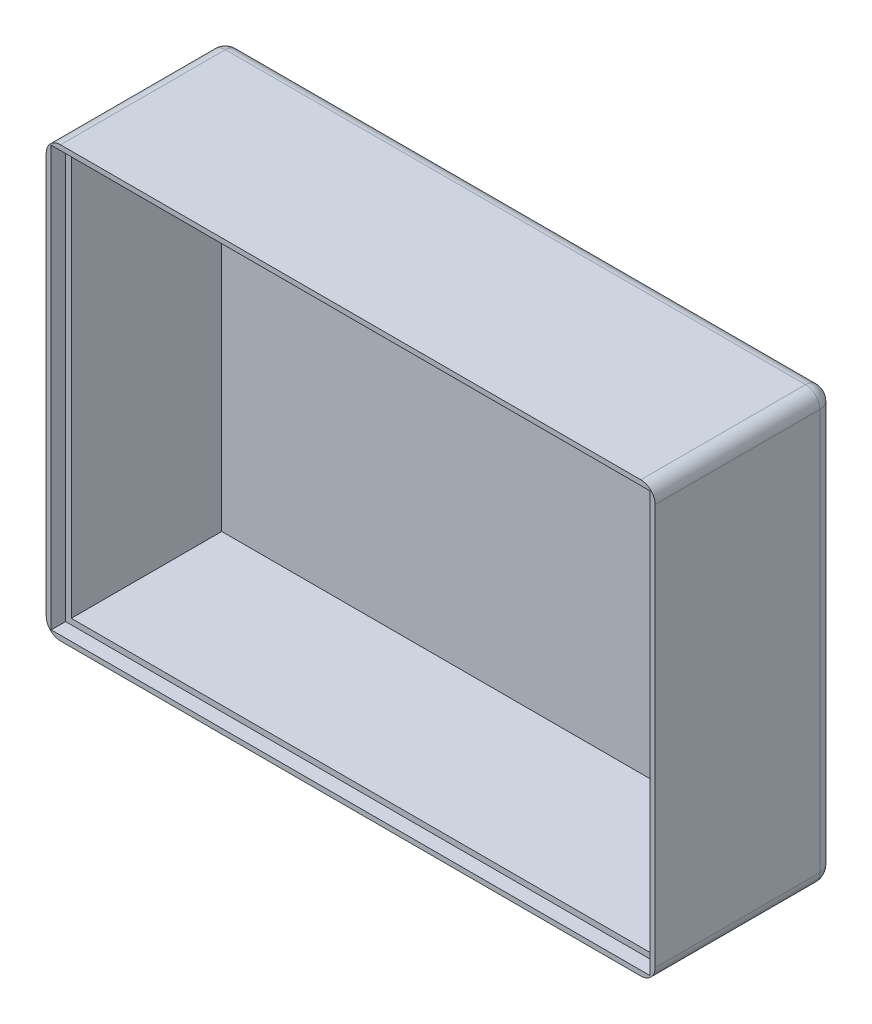
from build123d import *

# Parameters (mm, degrees)
SKETCH_1_W          = 85
SKETCH_1_H          = 60
EXTRUDE_1_DEPTH     = 25
SKETCH_2_W          = 82
SKETCH_2_H          = 57
CUT_EXTRUDE_1_DEPTH = 23
SKETCH_3_W          = 83.6
SKETCH_3_H          = 58.6
CUT_EXTRUDE_2_DEPTH = 2
FILLET_1_R          = 2


with BuildPart() as part:
    # 草图1 → 凸台-拉伸1 (new body)
    with BuildSketch(Plane.XY):
        with Locations((42.5, -30)):
            Rectangle(SKETCH_1_W, SKETCH_1_H)
    extrude(amount=EXTRUDE_1_DEPTH)

    # 草图2 → 切除-拉伸1 (cut)
    with BuildSketch(Plane.XY.offset(25)):
        with Locations((42.5, -30)):
            Rectangle(SKETCH_2_W, SKETCH_2_H)
    extrude(amount=-CUT_EXTRUDE_1_DEPTH, mode=Mode.SUBTRACT)

    # 草图3 → 切除-拉伸2 (cut)
    with BuildSketch(Plane.XY.offset(25)):
        with Locations((42.5, -30)):
            Rectangle(SKETCH_3_W, SKETCH_3_H)
    extrude(amount=-CUT_EXTRUDE_2_DEPTH, mode=Mode.SUBTRACT)

    # 圆角1
    fillet_1_edges = [part.edges().sort_by_distance(p)[0] for p in [
        (0, -30, 0),
        (42.5, -60, 0),
        (85, -30, 0),
        (42.5, 0, 0),
        (0, 0, 12.5),
        (0, -60, 12.5),
        (85, -60, 12.5),
        (85, 0, 12.5),
    ]]
    fillet(fillet_1_edges, radius=FILLET_1_R)


solid = part.part
